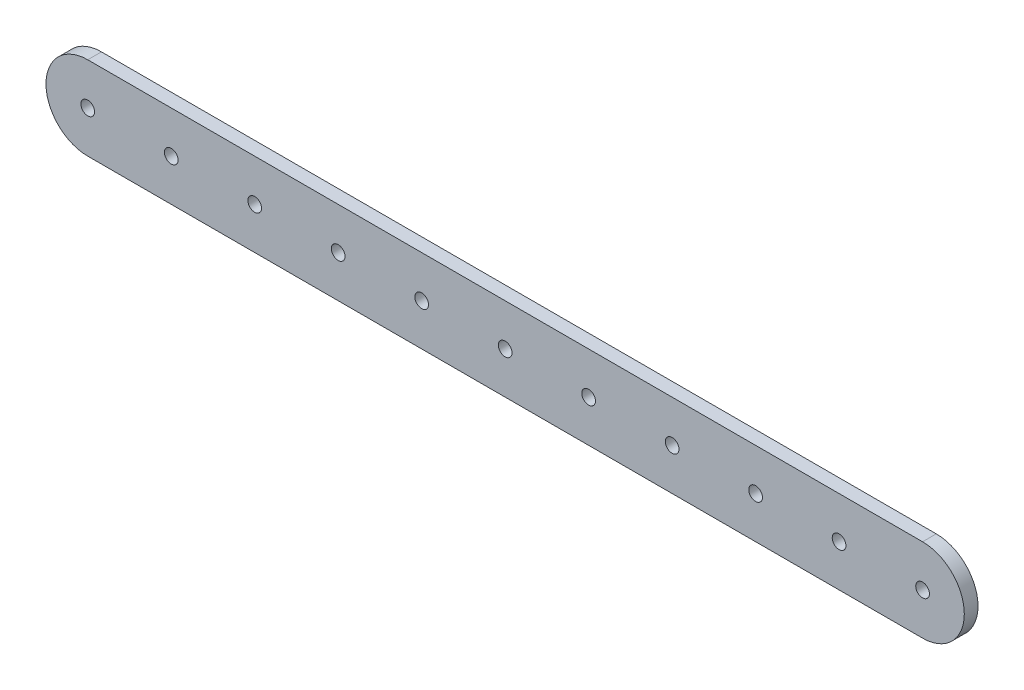
from build123d import *

# Parameters (mm, degrees)
BOSS_EXTRUDE1_DEPTH = 50
SKETCH2_R           = 25
CUT_EXTRUDE1_DEPTH  = 50
LPATTERN1_COUNT     = 11
LPATTERN1_PITCH     = 304.8


with BuildPart() as part:
    # Sketch1 → Boss-Extrude1 (new body)
    with BuildSketch(Plane.XY):
        with BuildLine():
            Line((-1416.627272727, 152.4), (1631.372727273, 152.4))
            ThreePointArc((1631.372727273, 152.4), (1783.772727273, 0), (1631.372727273, -152.4))
            Line((1631.372727273, -152.4), (-1416.627272727, -152.4))
            ThreePointArc((-1416.627272727, -152.4), (-1569.027272727, 0), (-1416.627272727, 152.4))
        make_face()
    extrude(amount=BOSS_EXTRUDE1_DEPTH)

    # Sketch2 → Cut-Extrude1 (cut)
    with BuildSketch(Plane.XY.offset(50)):
        with Locations((1631.372727273, 0)):
            Circle(SKETCH2_R)
    cut_extrude1 = extrude(amount=-CUT_EXTRUDE1_DEPTH, mode=Mode.SUBTRACT)

    # LPattern1: Cut-Extrude1 ×11
    with Locations(*[(-i * LPATTERN1_PITCH, 0, 0) for i in range(1, LPATTERN1_COUNT)]):
        add(cut_extrude1, mode=Mode.SUBTRACT)


solid = part.part
